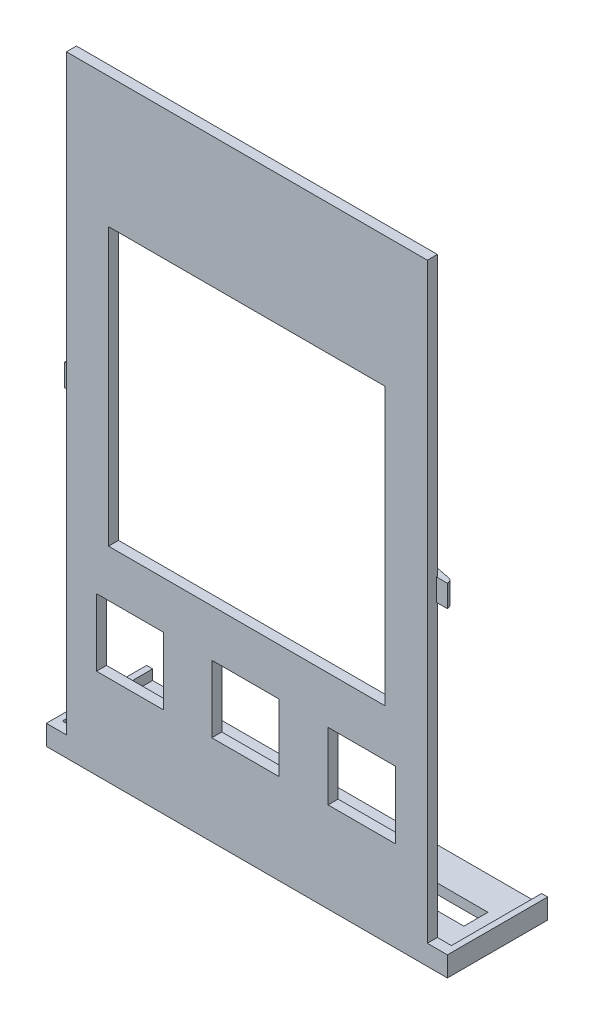
from build123d import *

# Parameters (mm, degrees)
SKETCH_1_W             = 40
SKETCH_1_H             = 62
EXTRUDE_1_DEPTH        = 1
SKETCH_3_W             = 27.6
SKETCH_3_H             = 27.6
SKETCH_3_W_2           = 6.7
SKETCH_3_H_2           = 6.7
CUT_EXTRUDE_1_DEPTH    = 37.905284174
EXTRUDE_2_DEPTH        = 1
SKETCH_8_W             = 40
SKETCH_8_H             = 1
EXTRUDE_5_DEPTH        = 1
SKETCH_10_W            = 0.6
SKETCH_10_H            = 2
EXTRUDE_6_DEPTH        = 9
SKETCH_11_W            = 38.8
SKETCH_11_H            = 1
EXTRUDE_7_DEPTH        = 9
CUT_EXTRUDE_2_REACH    = 68.708
SKETCH_13_W            = 7.2
SKETCH_13_H            = 2.2
SKETCH_13_W_2          = 9.4
SKETCH_13_H_2          = 3.8
SKETCH_13_W_3          = 15
SKETCH_13_H_3          = 2.4
CUT_EXTRUDE_3_DEPTH    = 10
SKETCH_15_W            = 0.891909811
SKETCH_15_H            = 2.2
EXTRUDE_8_DEPTH        = 2.2
CUT_EXTRUDE_4_REACH    = 41.79
FILLET_1_R             = 0.5
FILLET_1_OF_MIRROR_1_R = 0.5


with BuildPart() as part:
    # 草图1 → 凸台-拉伸1 (new body)
    with BuildSketch(Plane.XY):
        Rectangle(SKETCH_1_W, SKETCH_1_H)
    extrude(amount=EXTRUDE_1_DEPTH)

    # 草图3 → 切除-拉伸1 (cut, through all)
    with BuildSketch(Plane.XY.offset(1)):
        with Locations((0, 2.2)):
            Rectangle(SKETCH_3_W, SKETCH_3_H)
        with Locations((-11.65, -19.65)):
            Rectangle(SKETCH_3_W_2, SKETCH_3_H_2)
        with Locations((-0.15, -19.65)):
            Rectangle(SKETCH_3_W_2, SKETCH_3_H_2)
        with Locations((11.45, -19.65)):
            Rectangle(SKETCH_3_W_2, SKETCH_3_H_2)
    extrude(amount=-CUT_EXTRUDE_1_DEPTH, mode=Mode.SUBTRACT)

    # 草图4 → 凸台-拉伸2 (add)
    with BuildSketch(Plane(origin=(0, 0, 0), x_dir=(-1, 0, 0), z_dir=(0, 0, -1))):
        Polygon((-16.9, 22.527428343), (-16.2, 22.527428343), (-16.2, -13.6), (16.2, -13.6), (16.2, 22.527428343), (16.9, 22.527428343), (16.9, -14.3), (15.9, -14.3), (-15.9, -14.3), (-16.9, -14.3), align=None)
    extrude(amount=EXTRUDE_2_DEPTH)

    # 草图8 → 凸台-拉伸5 (add)
    with BuildSketch(Plane.XZ.offset(31)):
        with Locations((0, 0.5)):
            Rectangle(SKETCH_8_W, SKETCH_8_H)
    extrude(amount=EXTRUDE_5_DEPTH)

    # 草图10 → 凸台-拉伸6 (add)
    with BuildSketch(Plane(origin=(0, 0, 0), x_dir=(-1, 0, 0), z_dir=(0, 0, -1))):
        with Locations((-19.7, -31)):
            Rectangle(SKETCH_10_W, SKETCH_10_H)
        with Locations((19.7, -31)):
            Rectangle(SKETCH_10_W, SKETCH_10_H)
    extrude(amount=EXTRUDE_6_DEPTH)

    # 草图11 → 凸台-拉伸7 (add)
    with BuildSketch(Plane(origin=(0, 0, 0), x_dir=(-1, 0, 0), z_dir=(0, 0, -1))):
        with Locations((0, -31.5)):
            Rectangle(SKETCH_11_W, SKETCH_11_H)
    extrude(amount=EXTRUDE_7_DEPTH)

    # 草图13 → 切除-拉伸2 (cut, up to next)
    with BuildSketch(Plane.XZ.offset(32), mode=Mode.PRIVATE) as cut_extrude_2_sk1:
        with Locations((-14.554254311, -4.4)):
            Rectangle(SKETCH_13_W, SKETCH_13_H)
    cut_extrude_2_tool1 = extrude(cut_extrude_2_sk1.sketch, amount=-CUT_EXTRUDE_2_REACH, mode=Mode.PRIVATE) & part.part
    # 草图13 → 切除-拉伸2 (cut, up to next)
    with BuildSketch(Plane.XZ.offset(32), mode=Mode.PRIVATE) as cut_extrude_2_sk2:
        with Locations((-4.454254311, -5.1)):
            Rectangle(SKETCH_13_W_2, SKETCH_13_H_2)
    cut_extrude_2_tool2 = extrude(cut_extrude_2_sk2.sketch, amount=-CUT_EXTRUDE_2_REACH, mode=Mode.PRIVATE) & part.part
    # 草图13 → 切除-拉伸2 (cut, up to next)
    with BuildSketch(Plane.XZ.offset(32), mode=Mode.PRIVATE) as cut_extrude_2_sk3:
        with Locations((9.845745689, -4.5)):
            Rectangle(SKETCH_13_W_3, SKETCH_13_H_3)
    cut_extrude_2_tool3 = extrude(cut_extrude_2_sk3.sketch, amount=-CUT_EXTRUDE_2_REACH, mode=Mode.PRIVATE) & part.part
    add(cut_extrude_2_tool1.solids().sort_by_distance((-14.554254, -32, -4.4))[0], mode=Mode.SUBTRACT)
    add(cut_extrude_2_tool2.solids().sort_by_distance((-4.454254, -32, -5.1))[0], mode=Mode.SUBTRACT)
    add(cut_extrude_2_tool3.solids().sort_by_distance((9.845746, -32, -4.5))[0], mode=Mode.SUBTRACT)

    # 草图14 → 切除-拉伸3 (cut)
    with BuildSketch(Plane.XY.offset(1)):
        Polygon((-20, 31), (-18, 31), (18, 31), (20, 31), (20, -30), (18, -30), (18, 29), (-18, 29), (-18, -30), (-20, -30), align=None)
    extrude(amount=-CUT_EXTRUDE_3_DEPTH, mode=Mode.SUBTRACT)

    # 草图15 → 凸台-拉伸8 (add)
    with BuildSketch(Plane.ZY.offset(16.9)):
        with Locations((-0.345954906, 0.1)):
            Rectangle(SKETCH_15_W, SKETCH_15_H)
    extrude_8 = extrude(amount=EXTRUDE_8_DEPTH)

    # 草图16 → 切除-拉伸4 (cut, up to next)
    with BuildSketch(Plane(origin=(0, 1.2, 0), x_dir=(1, 0, 0), z_dir=(0, 1, 0)), mode=Mode.PRIVATE) as cut_extrude_4_sk1:
        Polygon((-16.9, 0.791909811), (-19.1, 0.345954906), (-19.1, 0.791909811), align=None)
    cut_extrude_4_tool1 = extrude(cut_extrude_4_sk1.sketch, amount=-CUT_EXTRUDE_4_REACH, mode=Mode.PRIVATE) & part.part
    cut_extrude_4 = cut_extrude_4_tool1.solids().sort_by_distance((-18.366667, 1.2, -0.643258))[0]
    add(cut_extrude_4, mode=Mode.SUBTRACT)

    # 圆角1
    fillet_1_edges = [part.edges().sort_by_distance(p)[0] for p in [
        (-19.1, 0.1, -0.345954906),
    ]]
    fillet(fillet_1_edges, radius=FILLET_1_R)

    # 镜向1: 凸台-拉伸8, 切除-拉伸4 across plane
    add(extrude_8.mirror(Plane(origin=(0, 0, 0), x_dir=(0, 0, 1), z_dir=(1, 0, 0))))
    add(cut_extrude_4.mirror(Plane(origin=(0, 0, 0), x_dir=(0, 0, 1), z_dir=(1, 0, 0))), mode=Mode.SUBTRACT)

    # 圆角1 of 镜向1
    fillet_1_of_mirror_1_edges = [part.edges().sort_by_distance(p)[0] for p in [
        (19.1, 0.1, -0.345954906),
    ]]
    fillet(fillet_1_of_mirror_1_edges, radius=FILLET_1_OF_MIRROR_1_R)


solid = part.part
